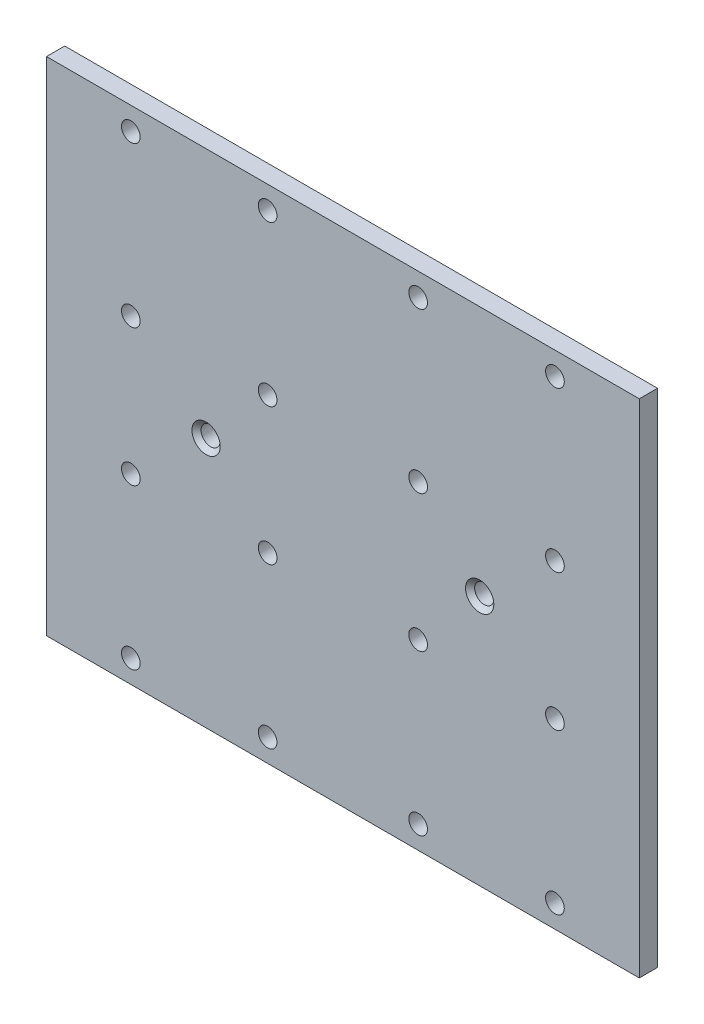
from build123d import *

# Parameters (mm, degrees)
SKETCH_1_W          = 130
SKETCH_1_H          = 110
EXTRUDE_1_DEPTH     = 5
SKETCH_4_R          = 2.05
CUT_EXTRUDE_1_DEPTH = 5
CHAMFER_2_SIZE      = 1
SKETCH_6_W          = 20
SKETCH_6_H          = 20
EXTRUDE_2_DEPTH     = 5
CHAMFER_3_SIZE      = 3
SKETCH_7_R          = 2.1
CUT_EXTRUDE_2_DEPTH = 49
CHAMFER_4_SIZE      = 1
SKETCH_8_W          = 0.5
SKETCH_8_H          = 110
CUT_EXTRUDE_3_DEPTH = 0.5


with BuildPart() as part:
    # 草图1 → 凸台-拉伸1 (new body)
    with BuildSketch(Plane.XY):
        with Locations((65, -55)):
            Rectangle(SKETCH_1_W, SKETCH_1_H)
    extrude(amount=EXTRUDE_1_DEPTH)

    # 草图4 → 切除-拉伸1 (cut)
    with BuildSketch(Plane(origin=(0, 0, 0), x_dir=(-1, 0, 0), z_dir=(0, 0, -1))):
        with Locations((-111.5, -5)):
            Circle(SKETCH_4_R)
        with Locations((-81.5, -5)):
            Circle(SKETCH_4_R)
        with Locations((-111.5, -40)):
            Circle(SKETCH_4_R)
        with Locations((-81.5, -40)):
            Circle(SKETCH_4_R)
        with Locations(Location((-48.5, -40, 0), (0, 0, 180))):
            Circle(SKETCH_4_R)
        with Locations(Location((-18.5, -40, 0), (0, 0, 180))):
            Circle(SKETCH_4_R)
        with Locations(Location((-18.5, -5, 0), (0, 0, 180))):
            Circle(SKETCH_4_R)
        with Locations(Location((-48.5, -5, 0), (0, 0, 180))):
            Circle(SKETCH_4_R)
        with Locations((-48.5, -105)):
            Circle(SKETCH_4_R)
        with Locations((-18.5, -105)):
            Circle(SKETCH_4_R)
        with Locations((-18.5, -70)):
            Circle(SKETCH_4_R)
        with Locations((-48.5, -70)):
            Circle(SKETCH_4_R)
        with Locations(Location((-81.5, -70, 0), (0, 0, 180))):
            Circle(SKETCH_4_R)
        with Locations(Location((-111.5, -70, 0), (0, 0, 180))):
            Circle(SKETCH_4_R)
        with Locations(Location((-81.5, -105, 0), (0, 0, 180))):
            Circle(SKETCH_4_R)
        with Locations(Location((-111.5, -105, 0), (0, 0, 180))):
            Circle(SKETCH_4_R)
    extrude(amount=-CUT_EXTRUDE_1_DEPTH, mode=Mode.SUBTRACT)

    # 倒角2
    chamfer_2_edges = [part.edges().sort_by_distance(p)[0] for p in [
        (50.55, -105, 0),
        (46.45, -5, 0),
        (16.45, -5, 0),
        (16.45, -40, 0),
        (83.55, -5, 0),
        (113.55, -40, 0),
        (83.55, -40, 0),
        (65, 0, 0),
        (46.45, -40, 0),
        (109.45, -70, 0),
        (130, -55, 0),
        (79.45, -105, 0),
        (109.45, -105, 0),
        (65, -110, 0),
        (79.45, -70, 0),
        (50.55, -70, 0),
        (0, -55, 0),
        (20.55, -70, 0),
        (20.55, -105, 0),
        (113.55, -5, 0),
    ]]
    chamfer(chamfer_2_edges, length=CHAMFER_2_SIZE)

    # 草图6 → 凸台-拉伸2 (add)
    with BuildSketch(Plane(origin=(0, 0, 0), x_dir=(-1, 0, 0), z_dir=(0, 0, -1))):
        with Locations((-95, -55)):
            Rectangle(SKETCH_6_W, SKETCH_6_H)
        with Locations((-35, -55)):
            Rectangle(SKETCH_6_W, SKETCH_6_H)
    extrude(amount=EXTRUDE_2_DEPTH)

    # 倒角3
    chamfer_3_edges = [part.edges().sort_by_distance(p)[0] for p in [
        (105, -55, 0),
        (85, -55, 0),
        (45, -55, 0),
        (25, -55, 0),
    ]]
    chamfer(chamfer_3_edges, length=CHAMFER_3_SIZE)

    # 草图7 → 切除-拉伸2 (cut)
    with BuildSketch(Plane(origin=(0, 0, -5), x_dir=(-1, 0, 0), z_dir=(0, 0, -1))):
        with Locations((-95, -55)):
            Circle(SKETCH_7_R)
        with Locations((-35, -55)):
            Circle(SKETCH_7_R)
    extrude(amount=-CUT_EXTRUDE_2_DEPTH, mode=Mode.SUBTRACT)

    # 倒角4
    chamfer_4_edges = [part.edges().sort_by_distance(p)[0] for p in [
        (97.1, -55, 5),
        (37.1, -55, 5),
    ]]
    chamfer(chamfer_4_edges, length=CHAMFER_4_SIZE)

    # 草图8 → 切除-拉伸3 (cut)
    with BuildSketch(Plane(origin=(0, 0, 0), x_dir=(-1, 0, 0), z_dir=(0, 0, -1))):
        with Locations((-65, -55)):
            Rectangle(SKETCH_8_W, SKETCH_8_H)
    extrude(amount=-CUT_EXTRUDE_3_DEPTH, mode=Mode.SUBTRACT)


solid = part.part
